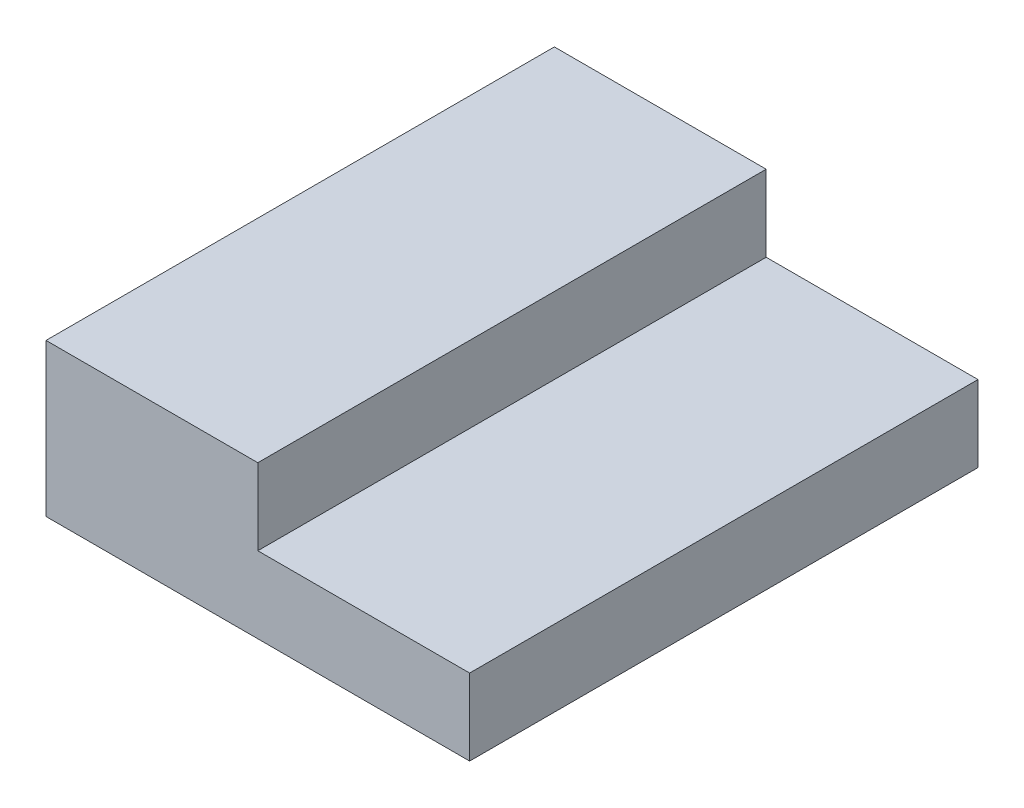
from build123d import *

# Parameters (mm, degrees)
BOSS_EXTRU_1_DEPTH = 60


with BuildPart() as part:
    # Esquisse1 → Boss.-Extru.1 (new body)
    with BuildSketch(Plane.XY):
        Polygon((0, 0), (50, 0), (50, 9), (25, 9), (25, 18), (0, 18), align=None)
    extrude(amount=BOSS_EXTRU_1_DEPTH)


solid = part.part
